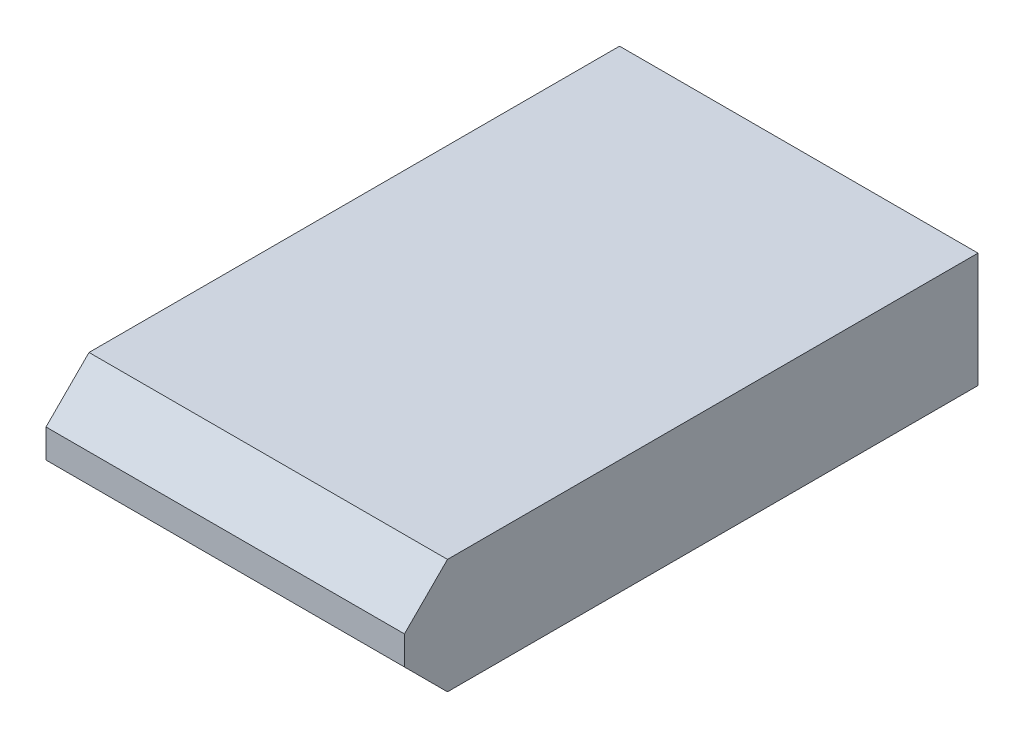
from build123d import *

# Parameters (mm, degrees)
SKETCH_1_W      = 25
SKETCH_1_H      = 40
EXTRUDE_1_DEPTH = 8
CHAMFER_1_SIZE  = 3


with BuildPart() as part:
    # 草图1 → 凸台-拉伸1 (new body)
    with BuildSketch(Plane(origin=(0, 0, 0), x_dir=(1, 0, 0), z_dir=(0, 1, 0))):
        with Locations((12.5, 20)):
            Rectangle(SKETCH_1_W, SKETCH_1_H)
    extrude(amount=EXTRUDE_1_DEPTH)

    # 倒角1
    chamfer_1_edges = [part.edges().sort_by_distance(p)[0] for p in [
        (12.5, 0, 0),
        (12.5, 8, 0),
    ]]
    chamfer(chamfer_1_edges, length=CHAMFER_1_SIZE)


solid = part.part
